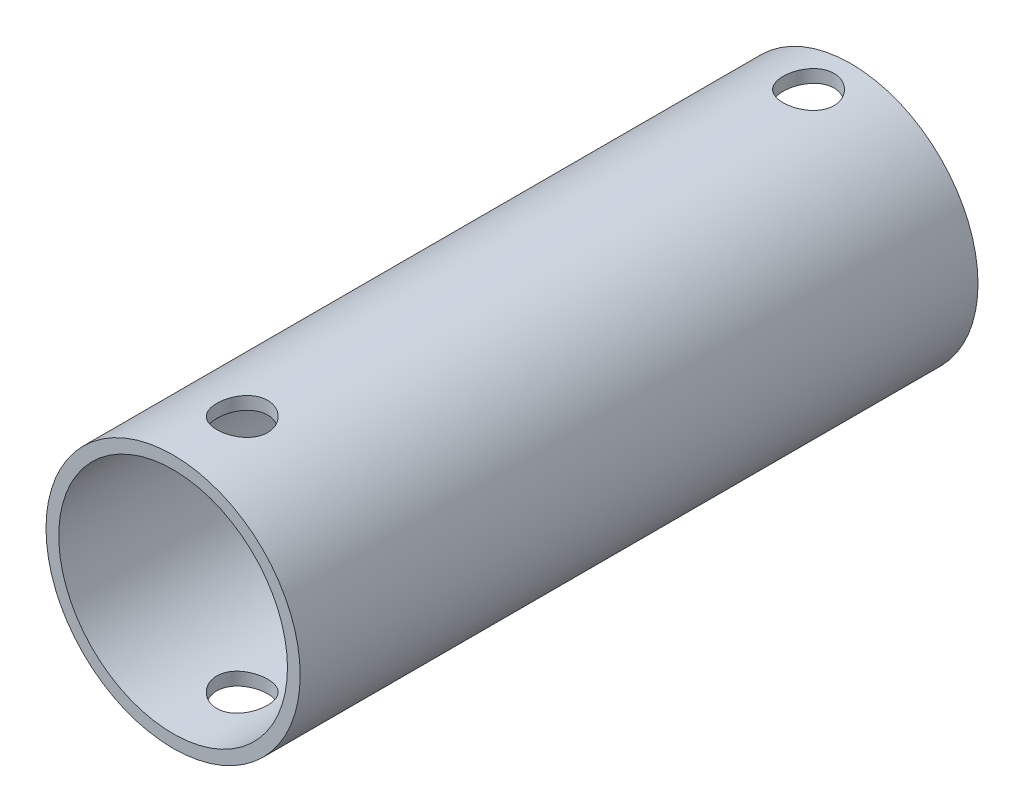
from build123d import *

# Parameters (mm, degrees)
SKETCH1_R           = 15
SKETCH1_R_2         = 13.5
BOSS_EXTRUDE1_DEPTH = 80
SKETCH2_R           = 3
CUT_EXTRUDE1_DEPTH  = 33
SKETCH3_R           = 3
CUT_EXTRUDE2_DEPTH  = 33


with BuildPart() as part:
    # Sketch1 → Boss-Extrude1 (new body)
    with BuildSketch(Plane.XY):
        Circle(SKETCH1_R)
        Circle(SKETCH1_R_2, mode=Mode.SUBTRACT)
    extrude(amount=BOSS_EXTRUDE1_DEPTH)

    # Sketch2 → Cut-Extrude1 (cut, symmetric)
    with BuildSketch(Plane(origin=(0, 0, 0), x_dir=(1, 0, 0), z_dir=(0, 1, 0))):
        with Locations(Location((0, -5, 0), (0, 0, 270))):
            Circle(SKETCH2_R)
    extrude(amount=CUT_EXTRUDE1_DEPTH, both=True, mode=Mode.SUBTRACT)

    # Sketch3 → Cut-Extrude2 (cut, symmetric)
    with BuildSketch(Plane.XZ):
        with Locations(Location((0, 71.839569, 0), (0, 0, 270))):
            Circle(SKETCH3_R)
    extrude(amount=CUT_EXTRUDE2_DEPTH, both=True, mode=Mode.SUBTRACT)


solid = part.part
